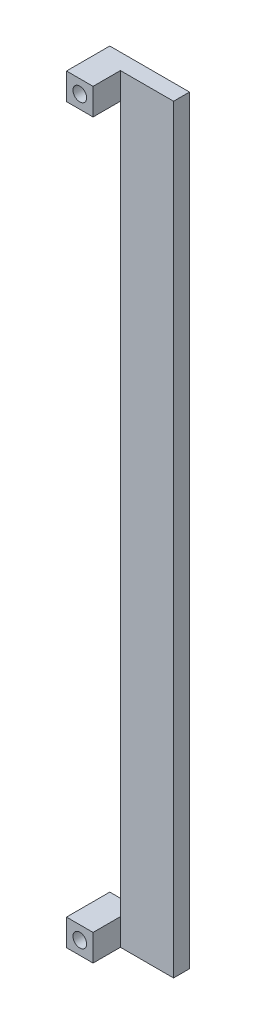
from build123d import *

# Parameters (mm, degrees)
SKETCH_1_W      = 14
SKETCH_1_H      = 200
EXTRUDE_1_DEPTH = 4.2
SKETCH_4_W      = 7
SKETCH_4_H      = 7
SKETCH_4_R      = 1.8
EXTRUDE_2_DEPTH = 11.4


with BuildPart() as part:
    # Эскиз1 → Бобышка-Вытянуть1 (new body)
    with BuildSketch(Plane.XY):
        with Locations((0.29682076, 87.872480945)):
            Rectangle(SKETCH_1_W, SKETCH_1_H)
    extrude(amount=EXTRUDE_1_DEPTH)

    # Эскиз4 → Бобышка-Вытянуть2 (add)
    # profile 1 of 2: a face of its own
    with BuildSketch(Plane.XY):
        with Locations((-10.20317924, -8.627519055)):
            Rectangle(SKETCH_4_W, SKETCH_4_H)
        with Locations((-10.20317924, -8.627519055)):
            Circle(SKETCH_4_R, mode=Mode.SUBTRACT)
    # profile 2 of 2: a face of its own
    with BuildSketch(Plane.XY):
        with Locations((-10.20317924, 184.372480945)):
            Rectangle(SKETCH_4_W, SKETCH_4_H)
        with Locations((-10.20317924, 184.372480945)):
            Circle(SKETCH_4_R, mode=Mode.SUBTRACT)
    extrude(amount=EXTRUDE_2_DEPTH)


solid = part.part
